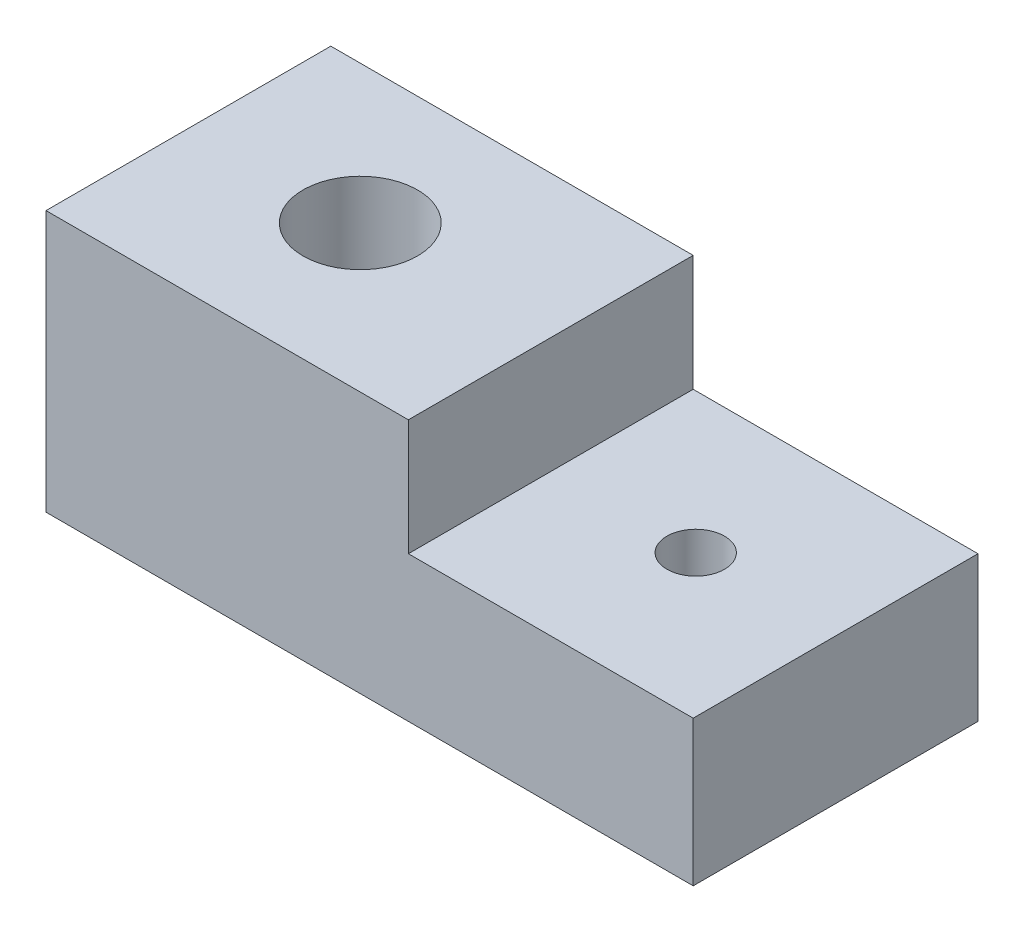
from build123d import *

# Parameters (mm, degrees)
SKETCH1_W             = 127.235427394
SKETCH1_H             = 91.719523319
BOSS_EXTRUDE1_DEPTH   = 100
SKETCH2_W             = 100
SKETCH2_H             = 50.996346368
BOSS_EXTRUDE2_DEPTH   = 100
F_1_0MM_DOWEL_HOLE1_D = 20.2
F_1_0MM_DOWEL_HOLE2_D = 40.2


with BuildPart() as part:
    # Sketch1 → Boss-Extrude1 (new body)
    with BuildSketch(Plane.XY):
        with Locations((63.617713697, 45.85976166)):
            Rectangle(SKETCH1_W, SKETCH1_H)
    extrude(amount=BOSS_EXTRUDE1_DEPTH)

    # Sketch2 → Boss-Extrude2 (add)
    with BuildSketch(Plane(origin=(127.235427394, 0, 0), x_dir=(0, 0, -1), z_dir=(1, 0, 0))):
        with Locations((-50, 25.498173184)):
            Rectangle(SKETCH2_W, SKETCH2_H)
    extrude(amount=BOSS_EXTRUDE2_DEPTH)

    # Ø1.0mm Dowel Hole1 (through all)
    with Locations(Plane(origin=(0, 50.996346368, 0), x_dir=(1, 0, 0), z_dir=(0, 1, 0))):
        with Locations((177.374375047, -49.243565035)):
            Hole(F_1_0MM_DOWEL_HOLE1_D / 2)

    # Ø1.0mm Dowel Hole2 (through all)
    with Locations(Plane(origin=(0, 91.719523319, 0), x_dir=(1, 0, 0), z_dir=(0, 1, 0))):
        with Locations((58.93827193, -48.595192208)):
            Hole(F_1_0MM_DOWEL_HOLE2_D / 2)


solid = part.part
